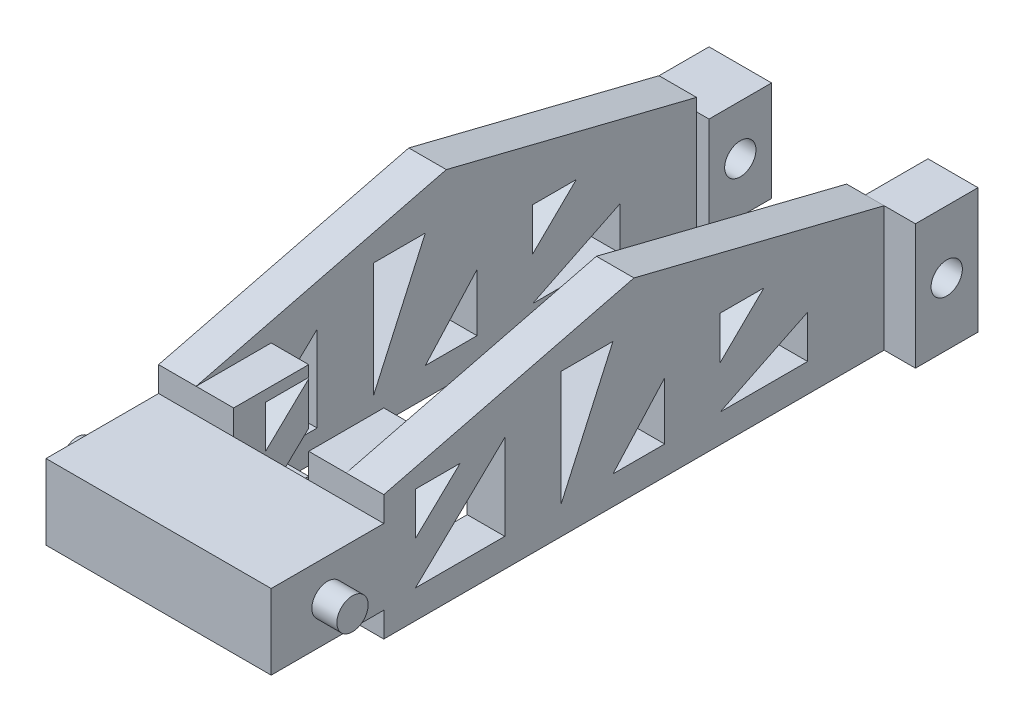
from build123d import *

# Parameters (mm, degrees)
SKETCH1_R                      = 12.5
BOSS_EXTRUDE1_DEPTH            = 20
SKETCH2_W                      = 90
SKETCH2_H                      = 60
BOSS_EXTRUDE2_DEPTH            = 90
SKETCH6_W                      = 60
SKETCH6_H                      = 100
BOSS_EXTRUDE4_DEPTH            = 400
SKETCH8_W                      = 120
SKETCH8_H                      = 340
CUT_EXTRUDE4_DEPTH             = 507.384241461
BOSS_EXTRUDE5_DEPTH            = 30
BOSS_EXTRUDE6_START            = -30
BOSS_EXTRUDE6_DEPTH            = 30
CUT_EXTRUDE6_DEPTH             = 180
SKETCH12_W                     = 50
SKETCH12_H                     = 80
BOSS_EXTRUDE7_DEPTH            = 50
SKETCH14_W                     = 40
SKETCH14_H                     = 100
BOSS_EXTRUDE8_DEPTH            = 50
SKETCH13_R                     = 12.5
CUT_EXTRUDE7_DEPTH             = 100
CUT_EXTRUDE7_DIRECTION_2_REACH = 533.272


with BuildPart() as part:
    # Sketch1 → Boss-Extrude1 (new body)
    with BuildSketch(Plane(origin=(0, 0, 0), x_dir=(0, 0, -1), z_dir=(1, 0, 0))):
        Circle(SKETCH1_R)
    extrude(amount=BOSS_EXTRUDE1_DEPTH)

    # Sketch2 → Boss-Extrude2 (add)
    with BuildSketch(Plane(origin=(20, 0, 0), x_dir=(0, 0, -1), z_dir=(1, 0, 0))):
        Rectangle(SKETCH2_W, SKETCH2_H)
    extrude(amount=BOSS_EXTRUDE2_DEPTH)

    # Mirror1: part across plane


with BuildPart() as part_1:
    add(part.part)
    add(part.part.mirror(Plane.ZY.offset(-110)))

    # Sketch6 → Boss-Extrude4 (add)
    with BuildSketch(Plane(origin=(0, 0, -45), x_dir=(-1, 0, 0), z_dir=(0, 0, -1))):
        with Locations((-50, 0)):
            Rectangle(SKETCH6_W, SKETCH6_H)
        with Locations((-170, 0)):
            Rectangle(SKETCH6_W, SKETCH6_H)
    extrude(amount=BOSS_EXTRUDE4_DEPTH)

    # Sketch8 → Cut-Extrude4 (cut, through all)
    with BuildSketch(Plane(origin=(0, 50, 0), x_dir=(1, 0, 0), z_dir=(0, 1, 0))):
        with Locations((110, 275)):
            Rectangle(SKETCH8_W, SKETCH8_H)
    extrude(amount=-CUT_EXTRUDE4_DEPTH, mode=Mode.SUBTRACT)

    # Sketch9 → Boss-Extrude5 (add)
    with BuildSketch(Plane.ZY.offset(-20)):
        Polygon((-445, 50), (-245, 100), (-45, 50), align=None)
    extrude(amount=-BOSS_EXTRUDE5_DEPTH)

    # Sketch10 → Boss-Extrude6 (add)
    with BuildSketch(Plane(origin=(200, 0, 0), x_dir=(0, 0, -1), z_dir=(1, 0, 0)).offset(BOSS_EXTRUDE6_START)):
        Polygon((245, 100), (445, 50), (45, 50), align=None)
    extrude(amount=BOSS_EXTRUDE6_DEPTH)

    # Sketch11 → Cut-Extrude6 (cut)
    with BuildSketch(Plane(origin=(200, 0, 0), x_dir=(0, 0, -1), z_dir=(1, 0, 0))):
        Polygon((70.294812967, 6.954060935), (106.010734034, 41.166153746), (70.294812967, 41.166153746), align=None)
        Polygon((70.294812967, -27.258031877), (141.726655101, -27.258031877), (141.726655101, 41.166153746), align=None)
        Polygon((186.841502765, 64.475491706), (228.19677979, 64.475491706), (186.841502765, -27.258031877), align=None)
        Polygon((228.19677979, -27.258031877), (269.552056815, -27.258031877), (269.552056815, 18.608729914), align=None)
        Polygon((313.914990351, 41.166153746), (348.87899729, 41.166153746), (313.914990351, 6.954060935), align=None)
        Polygon((313.914990351, -27.258031877), (383.843004229, -27.258031877), (383.843004229, 6.954060935), align=None)
    extrude(amount=-CUT_EXTRUDE6_DEPTH, mode=Mode.SUBTRACT)

    # Sketch12 → Boss-Extrude7 (add)
    with BuildSketch(Plane(origin=(0, 0, -445), x_dir=(-1, 0, 0), z_dir=(0, 0, -1))):
        with Locations((-35, 0)):
            Rectangle(SKETCH12_W, SKETCH12_H)
    extrude(amount=BOSS_EXTRUDE7_DEPTH)

    # Sketch14 → Boss-Extrude8 (add, through all)
    with BuildSketch(Plane(origin=(0, 0, -445), x_dir=(-1, 0, 0), z_dir=(0, 0, -1))):
        with Locations((-205, 0)):
            Rectangle(SKETCH14_W, SKETCH14_H)
    extrude(amount=BOSS_EXTRUDE8_DEPTH)

    # Sketch13 → Cut-Extrude7 (cut)
    with BuildSketch(Plane(origin=(60, 0, 0), x_dir=(0, 0, -1), z_dir=(1, 0, 0))):
        with Locations(Location((470, 0, 0), (0, 0, 180))):
            Circle(SKETCH13_R)
    extrude(amount=-CUT_EXTRUDE7_DEPTH, mode=Mode.SUBTRACT)

    # Sketch13 → Cut-Extrude7 direction 2 (cut, up to next)
    with BuildSketch(Plane(origin=(60, 0, 0), x_dir=(0, 0, -1), z_dir=(1, 0, 0)), mode=Mode.PRIVATE) as cut_extrude7_direction_2_sk1:
        with Locations(Location((470, 0, 0), (0, 0, 180))):
            Circle(SKETCH13_R)
    cut_extrude7_direction_2_tool1 = extrude(cut_extrude7_direction_2_sk1.sketch, amount=CUT_EXTRUDE7_DIRECTION_2_REACH, mode=Mode.PRIVATE) & part_1.part
    add(cut_extrude7_direction_2_tool1.solids().sort_by_distance((60, 0, -470))[0], mode=Mode.SUBTRACT)


solid = part_1.part
